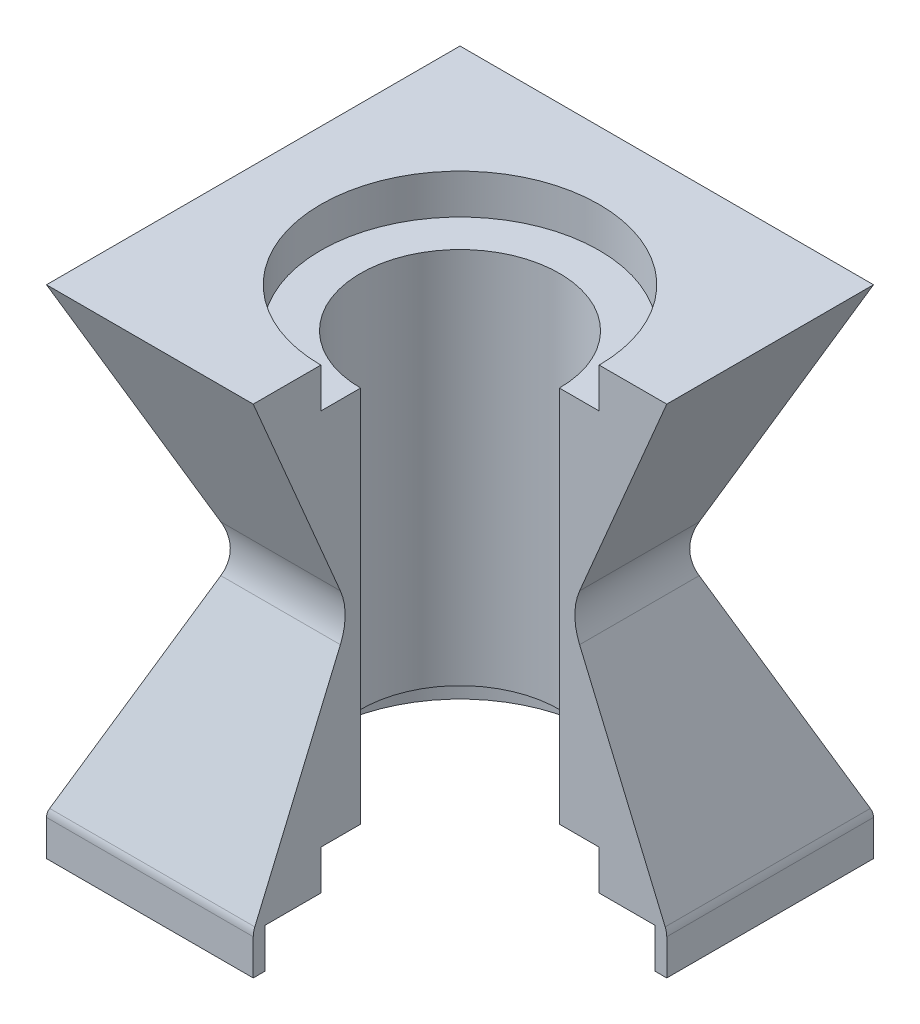
from build123d import *

# Parameters (mm, degrees)
SKETCH1_W           = 104
SKETCH1_H           = 104
SKETCH1_R           = 25
BOSS_EXTRUDE2_DEPTH = 115
CUT_EXTRUDE3_DEPTH  = 115
CUT_EXTRUDE4_DEPTH  = 115
FILLET1_R           = 15
SKETCH7_R           = 35
CUT_EXTRUDE7_DEPTH  = 10
CUT_EXTRUDE8_DEPTH  = 10000
CUT_EXTRUDE9_START  = -10
SKETCH9_R           = 35
CUT_EXTRUDE9_DEPTH  = 10
BOSS_EXTRUDE3_DEPTH = 10
CUT_EXTRUDE10_DEPTH = 10
FILLET2_R           = 5


with BuildPart() as part:
    # Sketch1 → Boss-Extrude2 (new body)
    with BuildSketch(Plane(origin=(0, 0, 0), x_dir=(1, 0, 0), z_dir=(0, 1, 0))):
        with Locations((52, 52)):
            Rectangle(SKETCH1_W, SKETCH1_H)
        with Locations(Location((52, 52, 0), (0, 0, 270))):
            Circle(SKETCH1_R, mode=Mode.SUBTRACT)
    extrude(amount=BOSS_EXTRUDE2_DEPTH)

    # Sketch5 → Cut-Extrude3 (cut)
    with BuildSketch(Plane(origin=(0, 0, -104), x_dir=(-1, 0, 0), z_dir=(0, 0, -1))):
        Polygon((-104, 115), (-104, 0), (-79.592698068, 57.5), align=None)
        Polygon((0, 0), (-24.407301932, 57.5), (0, 115), align=None)
    extrude(amount=-CUT_EXTRUDE3_DEPTH, mode=Mode.SUBTRACT)

    # Sketch4 → Cut-Extrude4 (cut)
    with BuildSketch(Plane(origin=(104, 0, 0), x_dir=(0, 0, -1), z_dir=(1, 0, 0))):
        Polygon((0, 115), (0, 0), (24.407301932, 57.5), align=None)
        Polygon((104, 0), (79.592698068, 57.5), (104, 115), align=None)
    extrude(amount=-CUT_EXTRUDE4_DEPTH, mode=Mode.SUBTRACT)

    # Fillet1
    fillet1_edges = [part.edges().sort_by_distance(p)[0] for p in [
        (79.592698068, 57.5, -52),
        (24.407301932, 57.5, -52),
        (52, 57.5, -24.407301932),
        (52, 57.5, -79.592698068),
    ]]
    fillet(fillet1_edges, radius=FILLET1_R)

    # Sketch7 → Cut-Extrude7 (cut)
    with BuildSketch(Plane(origin=(0, 115, 0), x_dir=(1, 0, 0), z_dir=(0, 1, 0))):
        with Locations(Location((52, 52, 0), (0, 0, 270))):
            Circle(SKETCH7_R)
    extrude(amount=-CUT_EXTRUDE7_DEPTH, mode=Mode.SUBTRACT)

    # Sketch8 → Cut-Extrude8 (cut)
    with BuildSketch(Plane(origin=(0, 115, 0), x_dir=(1, 0, 0), z_dir=(0, 1, 0))):
        with BuildLine():
            Line((52, -33.456206832), (52, 52))
            Line((52, 52), (137.456206832, 52))
            ThreePointArc((137.456206832, 52), (112.426663345, -8.426663345), (52, -33.456206832))
        make_face()
    extrude(amount=-CUT_EXTRUDE8_DEPTH, mode=Mode.SUBTRACT)

    # Sketch9 → Cut-Extrude9 (cut)
    with BuildSketch(Plane(origin=(0, 0, 0), x_dir=(-1, 0, 0), z_dir=(0, -1, 0)).offset(CUT_EXTRUDE9_START)):
        with Locations((-52, 52)):
            Circle(SKETCH9_R)
    extrude(amount=CUT_EXTRUDE9_DEPTH, mode=Mode.SUBTRACT)

    # Sketch10 → Boss-Extrude3 (add)
    with BuildSketch(Plane(origin=(0, 0, 0), x_dir=(-1, 0, 0), z_dir=(0, -1, 0))):
        Polygon((-104, 52), (-104, 104), (0, 104), (0, 0), (-52, 0), (-52, 3), (-3, 3), (-3, 101), (-101, 101), (-101, 52), align=None)
    extrude(amount=BOSS_EXTRUDE3_DEPTH)

    # Sketch11 → Cut-Extrude10 (cut)
    with BuildSketch(Plane(origin=(0, 0, 0), x_dir=(-1, 0, 0), z_dir=(0, -1, 0))):
        with BuildLine():
            Line((-19.826641456, 24.069282143), (-9.220039738, 13.462680425))
            ThreePointArc((-9.220039738, 13.462680425), (-9.220039738, 9.220039738), (-13.462680425, 9.220039738))
            Line((-13.462680425, 9.220039738), (-24.069282143, 19.826641456))
            ThreePointArc((-24.069282143, 19.826641456), (-24.069282143, 24.069282143), (-19.826641456, 24.069282143))
        make_face()
        with BuildLine():
            Line((-79.930717857, 84.173358544), (-90.537319575, 94.779960262))
            ThreePointArc((-90.537319575, 94.779960262), (-94.779960262, 94.779960262), (-94.779960262, 90.537319575))
            Line((-94.779960262, 90.537319575), (-84.173358544, 79.930717857))
            ThreePointArc((-84.173358544, 79.930717857), (-79.930717857, 79.930717857), (-79.930717857, 84.173358544))
        make_face()
        with BuildLine():
            Line((-19.826641456, 79.930717857), (-9.220039738, 90.537319575))
            ThreePointArc((-9.220039738, 90.537319575), (-9.220039738, 94.779960262), (-13.462680425, 94.779960262))
            Line((-13.462680425, 94.779960262), (-24.069282143, 84.173358544))
            ThreePointArc((-24.069282143, 84.173358544), (-24.069282143, 79.930717857), (-19.826641456, 79.930717857))
        make_face()
    extrude(amount=-CUT_EXTRUDE10_DEPTH, mode=Mode.SUBTRACT)

    # Fillet2
    fillet2_edges = [part.edges().sort_by_distance(p)[0] for p in [
        (104, 0, -78),
        (0, 0, -52),
        (52, 0, -104),
        (26, 0, 0),
    ]]
    fillet(fillet2_edges, radius=FILLET2_R)


solid = part.part
